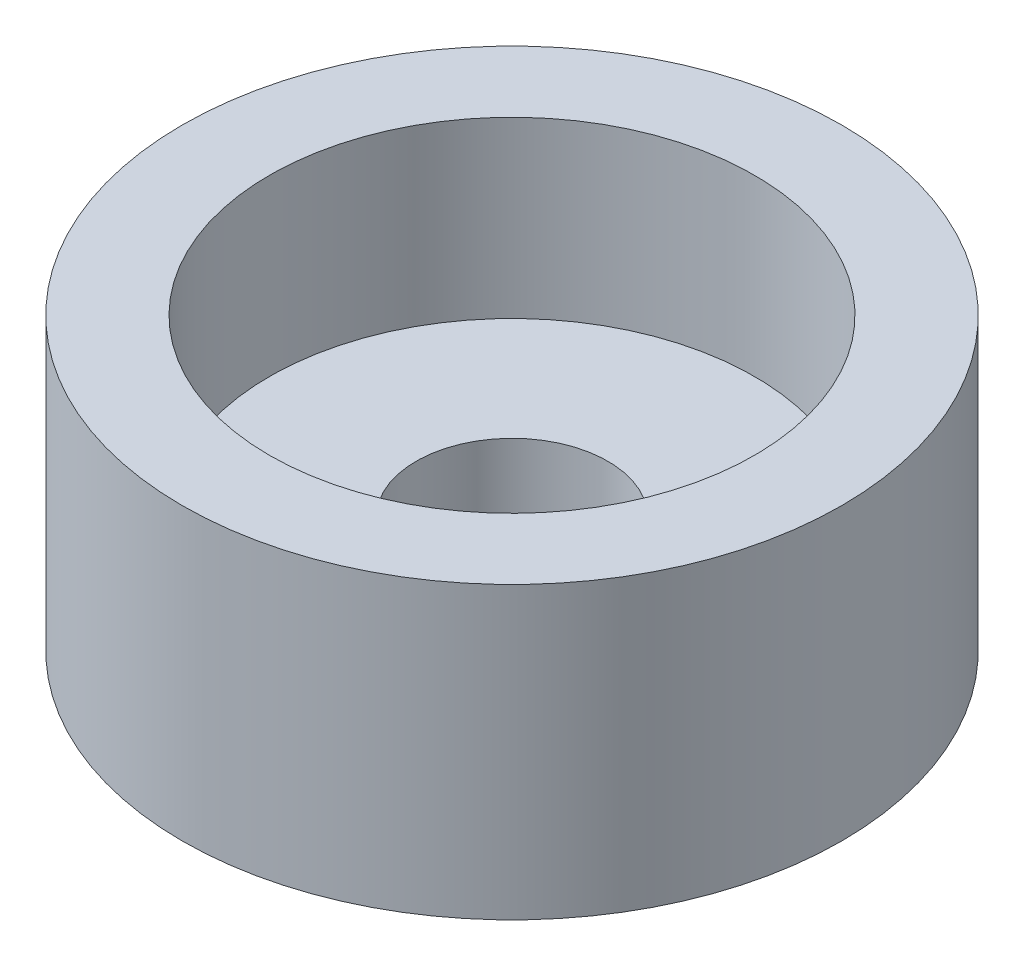
from build123d import *

# Parameters (mm, degrees)
ESBO_O1_R                = 5.675
ESBO_O1_R_2              = 1.65
RESSALTO_EXTRUS_O1_DEPTH = 2
ESBO_O2_R                = 5.675
ESBO_O2_R_2              = 4.175
RESSALTO_EXTRUS_O2_DEPTH = 3


with BuildPart() as part:
    # Esboço1 → Ressalto-extrusão1 (new body)
    with BuildSketch(Plane(origin=(0, 0, 0), x_dir=(1, 0, 0), z_dir=(0, 1, 0))):
        with Locations(Location((0, 0, 0), (0, 0, 270))):
            Circle(ESBO_O1_R)
        with Locations(Location((0, 0, 0), (0, 0, 270))):
            Circle(ESBO_O1_R_2, mode=Mode.SUBTRACT)
    extrude(amount=RESSALTO_EXTRUS_O1_DEPTH)

    # Esboço2 → Ressalto-extrusão2 (add)
    with BuildSketch(Plane(origin=(0, 2, 0), x_dir=(1, 0, 0), z_dir=(0, 1, 0))):
        with Locations(Location((0, 0, 0), (0, 0, 270))):
            Circle(ESBO_O2_R)
        with Locations(Location((0, 0, 0), (0, 0, 270))):
            Circle(ESBO_O2_R_2, mode=Mode.SUBTRACT)
    extrude(amount=RESSALTO_EXTRUS_O2_DEPTH)


solid = part.part
